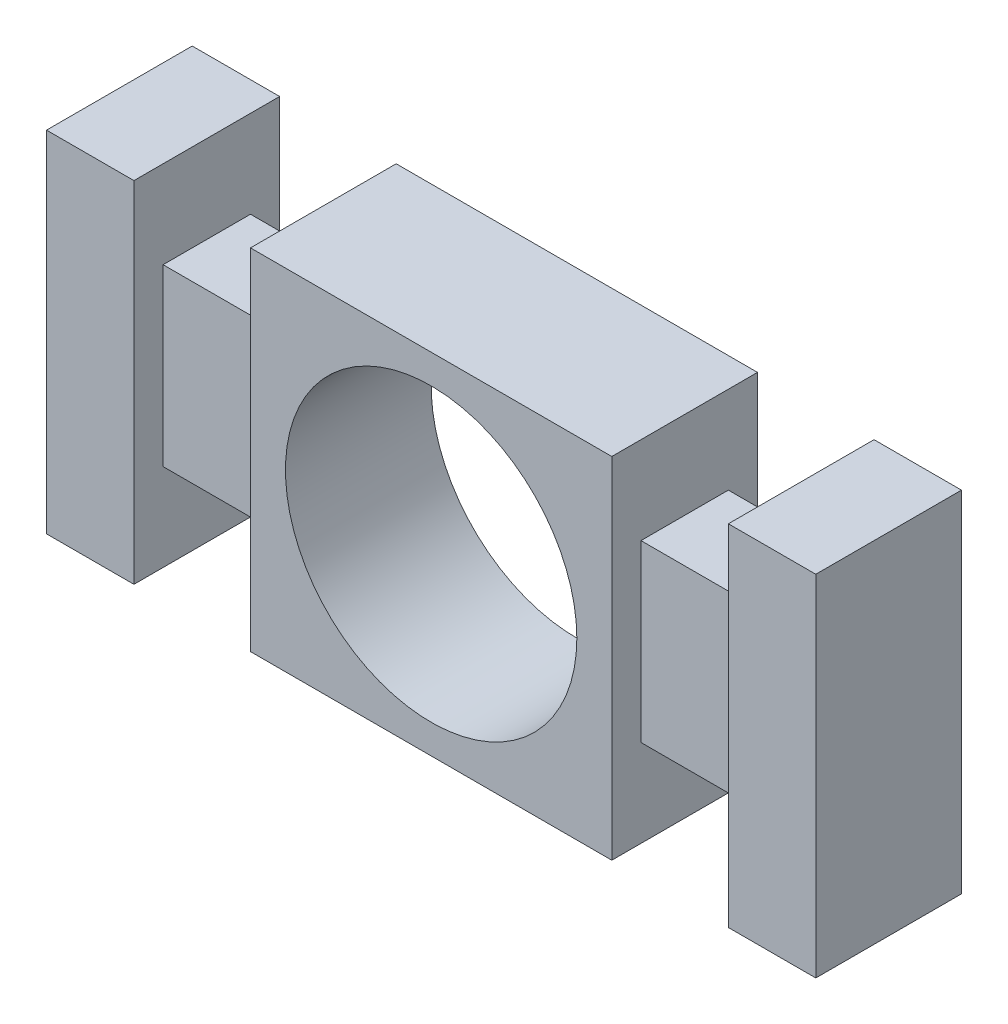
from build123d import *

# Parameters (mm, degrees)
SKETCH1_W           = 60
SKETCH1_H           = 132
BOSS_EXTRUDE1_DEPTH = 25
SKETCH2_W           = 20
SKETCH2_H           = 15
CUT_EXTRUDE1_DEPTH  = 77.68767828
SKETCH4_W           = 20
SKETCH4_H           = 30
CUT_EXTRUDE2_DEPTH  = 5
SKETCH5_W           = 20
SKETCH5_H           = 30
CUT_EXTRUDE3_DEPTH  = 5
SKETCH6_R           = 25
CUT_EXTRUDE4_DEPTH  = 77.68767828


with BuildPart() as part:
    # Sketch1 → Boss-Extrude1 (new body)
    with BuildSketch(Plane(origin=(0, 0, 0), x_dir=(0, 1, 0), z_dir=(0, 0, 1))):
        Rectangle(SKETCH1_W, SKETCH1_H)
    extrude(amount=BOSS_EXTRUDE1_DEPTH)

    # Sketch2 → Cut-Extrude1 (cut, through all)
    with BuildSketch(Plane.XY.offset(25)):
        with Locations((-41, 22.5)):
            Rectangle(SKETCH2_W, SKETCH2_H)
        with Locations((41, 22.5)):
            Rectangle(SKETCH2_W, SKETCH2_H)
        with Locations((41, -22.5)):
            Rectangle(SKETCH2_W, SKETCH2_H)
        with Locations((-41, -22.5)):
            Rectangle(SKETCH2_W, SKETCH2_H)
    extrude(amount=-CUT_EXTRUDE1_DEPTH, mode=Mode.SUBTRACT)

    # Sketch4 → Cut-Extrude2 (cut)
    with BuildSketch(Plane.XY.offset(25)):
        with Locations((-41, 0)):
            Rectangle(SKETCH4_W, SKETCH4_H)
        with Locations((41, 0)):
            Rectangle(SKETCH4_W, SKETCH4_H)
    extrude(amount=-CUT_EXTRUDE2_DEPTH, mode=Mode.SUBTRACT)

    # Sketch5 → Cut-Extrude3 (cut)
    with BuildSketch(Plane(origin=(0, 0, 0), x_dir=(1, 0, 0), z_dir=(0, 0, -1))):
        with Locations((-41, 0)):
            Rectangle(SKETCH5_W, SKETCH5_H)
        with Locations((41, 0)):
            Rectangle(SKETCH5_W, SKETCH5_H)
    extrude(amount=-CUT_EXTRUDE3_DEPTH, mode=Mode.SUBTRACT)

    # Sketch6 → Cut-Extrude4 (cut, through all)
    with BuildSketch(Plane.XY.offset(25)):
        Circle(SKETCH6_R)
    extrude(amount=-CUT_EXTRUDE4_DEPTH, mode=Mode.SUBTRACT)


solid = part.part
